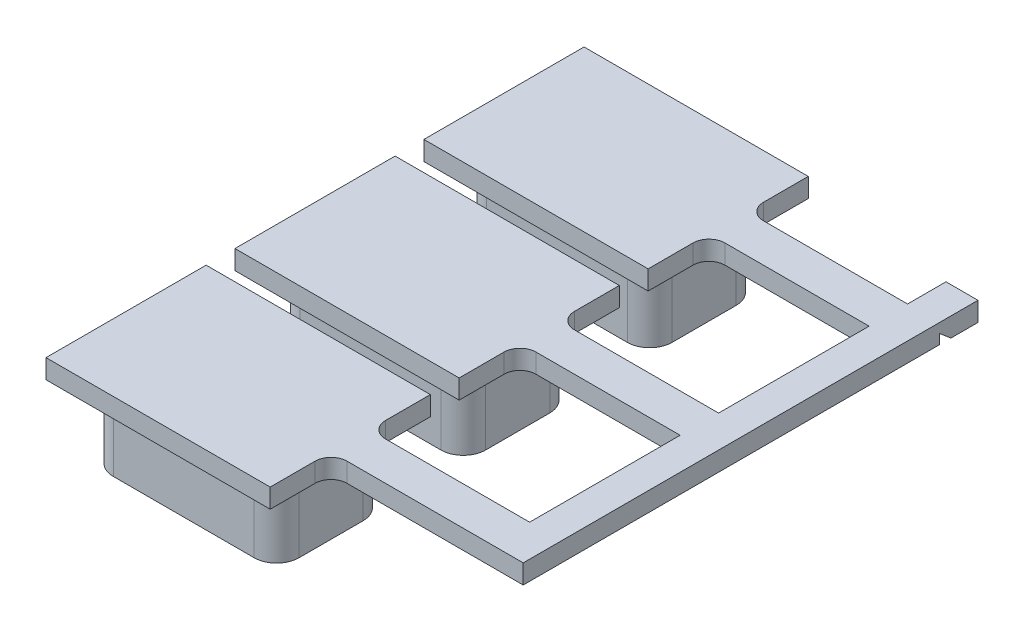
from build123d import *

# Parameters (mm, degrees)
EXTRUDE_1_DEPTH     = 3
EXTRUDE_1_2_DEPTH   = 3
EXTRUDE_1_3_DEPTH   = 3
SKETCH_2_W          = 7
SKETCH_2_H          = 5
EXTRUDE_2_DEPTH     = 0.6
SKETCH_3_W          = 6
SKETCH_3_H          = 1.2
EXTRUDE_3_DEPTH     = 0.6
SKETCH_4_W          = 1
SKETCH_4_H          = 13
EXTRUDE_4_DEPTH     = 0.6
FILLET_1_R          = 0.5
SKETCH_5_W          = 1
SKETCH_5_H          = 0.6
EXTRUDE_5_DEPTH     = 1.2
CUT_EXTRUDE_1_DEPTH = 1


with BuildPart() as part:
    # 草图1 → 凸台-拉伸1 (new body)
    with BuildSketch(Plane(origin=(0, 0, 0), x_dir=(1, 0, 0), z_dir=(0, 1, 0))):
        with BuildLine():
            Line((-2.2, 1.7), (2.2, 1.7))
            ThreePointArc((2.2, 1.7), (2.694974747, 1.494974747), (2.9, 1))
            Line((2.9, 1), (2.9, -1))
            ThreePointArc((2.9, -1), (2.694974747, -1.494974747), (2.2, -1.7))
            Line((2.2, -1.7), (-2.2, -1.7))
            ThreePointArc((-2.2, -1.7), (-2.694974747, -1.494974747), (-2.9, -1))
            Line((-2.9, -1), (-2.9, 1))
            ThreePointArc((-2.9, 1), (-2.694974747, 1.494974747), (-2.2, 1.7))
        make_face()
    extrude(amount=EXTRUDE_1_DEPTH)



with BuildPart() as body_2:
    # 草图1 → Extrude 1 2 (new body)
    with BuildSketch(Plane(origin=(0, 0, 0), x_dir=(1, 0, 0), z_dir=(0, 1, 0))):
        with BuildLine():
            Line((-2.2, 7.528722779), (2.2, 7.528722779))
            ThreePointArc((2.2, 7.528722779), (2.694974747, 7.323697526), (2.9, 6.828722779))
            Line((2.9, 6.828722779), (2.9, 4.828722779))
            ThreePointArc((2.9, 4.828722779), (2.694974747, 4.333748032), (2.2, 4.128722779))
            Line((2.2, 4.128722779), (-2.2, 4.128722779))
            ThreePointArc((-2.2, 4.128722779), (-2.694974747, 4.333748032), (-2.9, 4.828722779))
            Line((-2.9, 4.828722779), (-2.9, 6.828722779))
            ThreePointArc((-2.9, 6.828722779), (-2.694974747, 7.323697526), (-2.2, 7.528722779))
        make_face()
    extrude(amount=EXTRUDE_1_2_DEPTH)


with BuildPart() as body_3:
    # 草图1 → Extrude 1 3 (new body)
    with BuildSketch(Plane(origin=(0, 0, 0), x_dir=(1, 0, 0), z_dir=(0, 1, 0))):
        with BuildLine():
            Line((-2.2, 13.349128593), (2.2, 13.349128593))
            ThreePointArc((2.2, 13.349128593), (2.694974747, 13.144103339), (2.9, 12.649128593))
            Line((2.9, 12.649128593), (2.9, 10.649128593))
            ThreePointArc((2.9, 10.649128593), (2.694974747, 10.154153846), (2.2, 9.949128593))
            Line((2.2, 9.949128593), (-2.2, 9.949128593))
            ThreePointArc((-2.2, 9.949128593), (-2.694974747, 10.154153846), (-2.9, 10.649128593))
            Line((-2.9, 10.649128593), (-2.9, 12.649128593))
            ThreePointArc((-2.9, 12.649128593), (-2.694974747, 13.144103339), (-2.2, 13.349128593))
        make_face()
    extrude(amount=EXTRUDE_1_3_DEPTH)


with BuildPart() as part_1:
    add(part.part)

    add(body_2.part)  # 凸台-拉伸2 merges body 2

    add(body_3.part)  # 凸台-拉伸2 merges body 3
    # 草图2 → 凸台-拉伸2 (add)
    with BuildSketch(Plane(origin=(0, 3, 0), x_dir=(1, 0, 0), z_dir=(0, 1, 0))):
        with Locations((0.036699987, 11.763062551)):
            Rectangle(SKETCH_2_W, SKETCH_2_H)
        with Locations((0.036699987, 5.863062551)):
            Rectangle(SKETCH_2_W, SKETCH_2_H)
        with Locations((0.036699987, -0.036937449)):
            Rectangle(SKETCH_2_W, SKETCH_2_H)
    extrude(amount=-EXTRUDE_2_DEPTH)

    # 草图3 → 凸台-拉伸3 (add)
    with BuildSketch(Plane(origin=(0, 3, 0), x_dir=(1, 0, 0), z_dir=(0, 1, 0))):
        with Locations((6.536699987, 11.763062551)):
            Rectangle(SKETCH_3_W, SKETCH_3_H)
        with Locations((6.536699987, 5.863062551)):
            Rectangle(SKETCH_3_W, SKETCH_3_H)
        with Locations((6.536699987, -0.036937449)):
            Rectangle(SKETCH_3_W, SKETCH_3_H)
    extrude(amount=-EXTRUDE_3_DEPTH)

    # 草图4 → 凸台-拉伸4 (add)
    with BuildSketch(Plane.XZ.offset(-2.4)):
        with Locations((9.036699987, -5.863062551)):
            Rectangle(SKETCH_4_W, SKETCH_4_H)
    extrude(amount=-EXTRUDE_4_DEPTH)

    # 圆角1
    fillet_1_edges = [part_1.edges().sort_by_distance(p)[0] for p in [
        (3.536699987, 2.7, -11.163062551),
        (3.536699987, 2.7, -12.363062551),
        (3.536699987, 2.7, 0.636937449),
        (3.536699987, 2.7, -0.563062551),
        (3.536699987, 2.7, -5.263062551),
        (3.536699987, 2.7, -6.463062551),
    ]]
    fillet(fillet_1_edges, radius=FILLET_1_R)

    # 草图5 → 凸台-拉伸5 (add)
    with BuildSketch(Plane(origin=(0, 0, -12.363062551), x_dir=(-1, 0, 0), z_dir=(0, 0, -1))):
        with Locations((-9.036699987, 2.7)):
            Rectangle(SKETCH_5_W, SKETCH_5_H)
    extrude(amount=EXTRUDE_5_DEPTH)

    # 草图6 → 切除-拉伸1 (cut)
    with BuildSketch(Plane.ZY.offset(-8.536699987)):
        Polygon((-12.363062551, 2.4), (-12.363062551, 2.7), (-12.720178884, 2.4), align=None)
    extrude(amount=-CUT_EXTRUDE_1_DEPTH, mode=Mode.SUBTRACT)


solid = part_1.part
